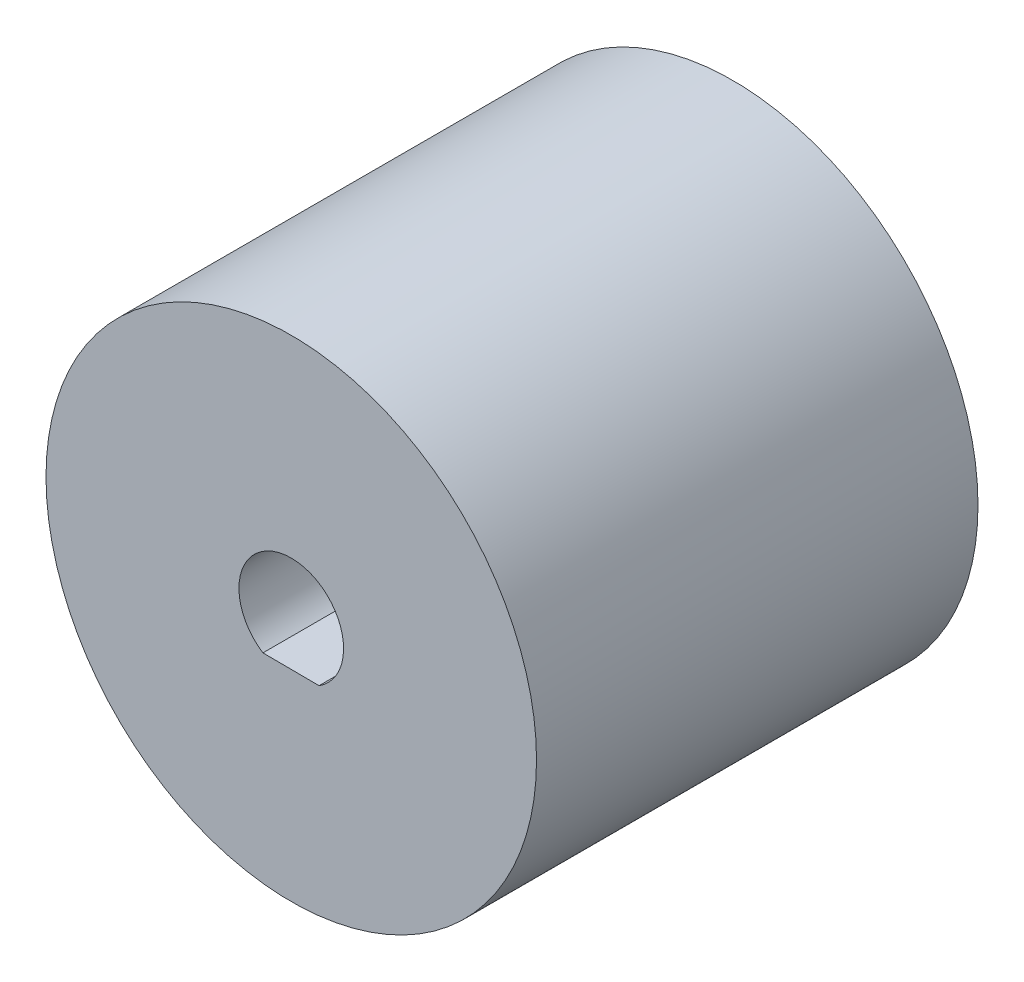
from build123d import *

# Parameters (mm, degrees)
SKETCH1_R           = 15
BOSS_EXTRUDE1_DEPTH = 27


with BuildPart() as part:
    # Sketch1 → Boss-Extrude1 (new body)
    with BuildSketch(Plane.XY):
        Circle(SKETCH1_R)
        with BuildLine():
            Line((-1.733311406, -2.689912929), (1.701742701, -2.709994794))
            ThreePointArc((1.701742701, -2.709994794), (0.018707381, 3.199945317), (-1.733311406, -2.689912929))
        make_face(mode=Mode.SUBTRACT)
    extrude(amount=BOSS_EXTRUDE1_DEPTH)


solid = part.part
